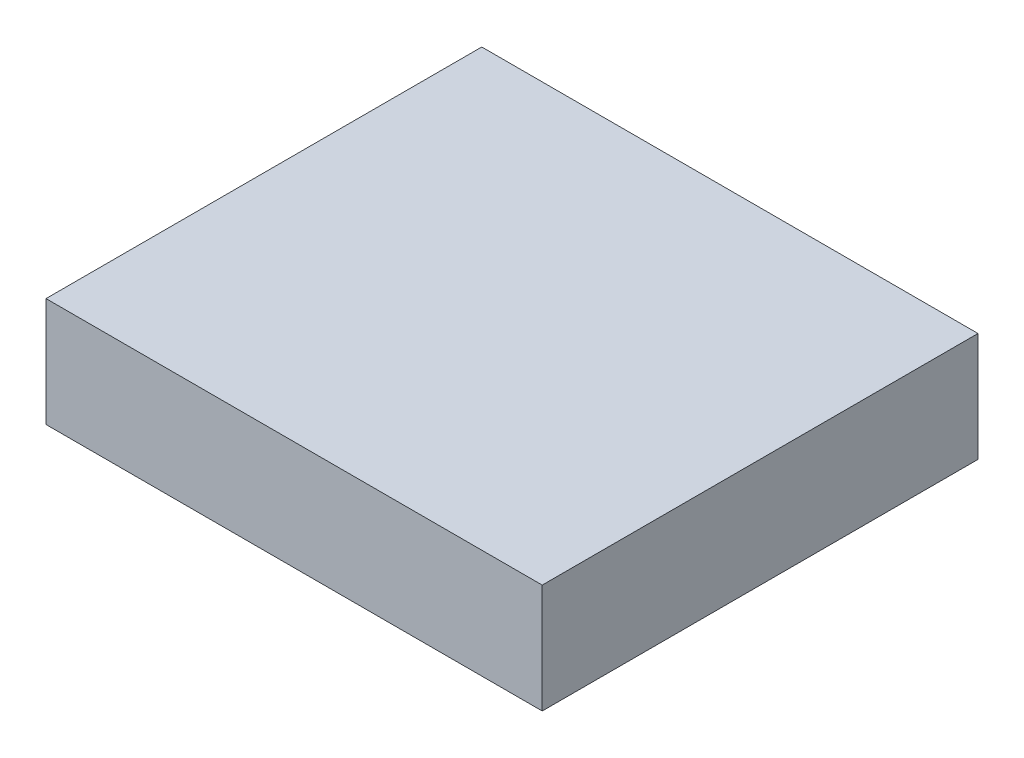
from build123d import *

# Parameters (mm, degrees)
SKETCH1_W           = 5.0038
SKETCH1_H           = 4.3942
BOSS_EXTRUDE1_DEPTH = 1.09982


with BuildPart() as part:
    # Sketch1 → Boss-Extrude1 (new body)
    with BuildSketch(Plane(origin=(0, 0, 0), x_dir=(1, 0, 0), z_dir=(0, 1, 0))):
        with Locations((2.5019, 2.1971)):
            Rectangle(SKETCH1_W, SKETCH1_H)
    extrude(amount=BOSS_EXTRUDE1_DEPTH)


solid = part.part
